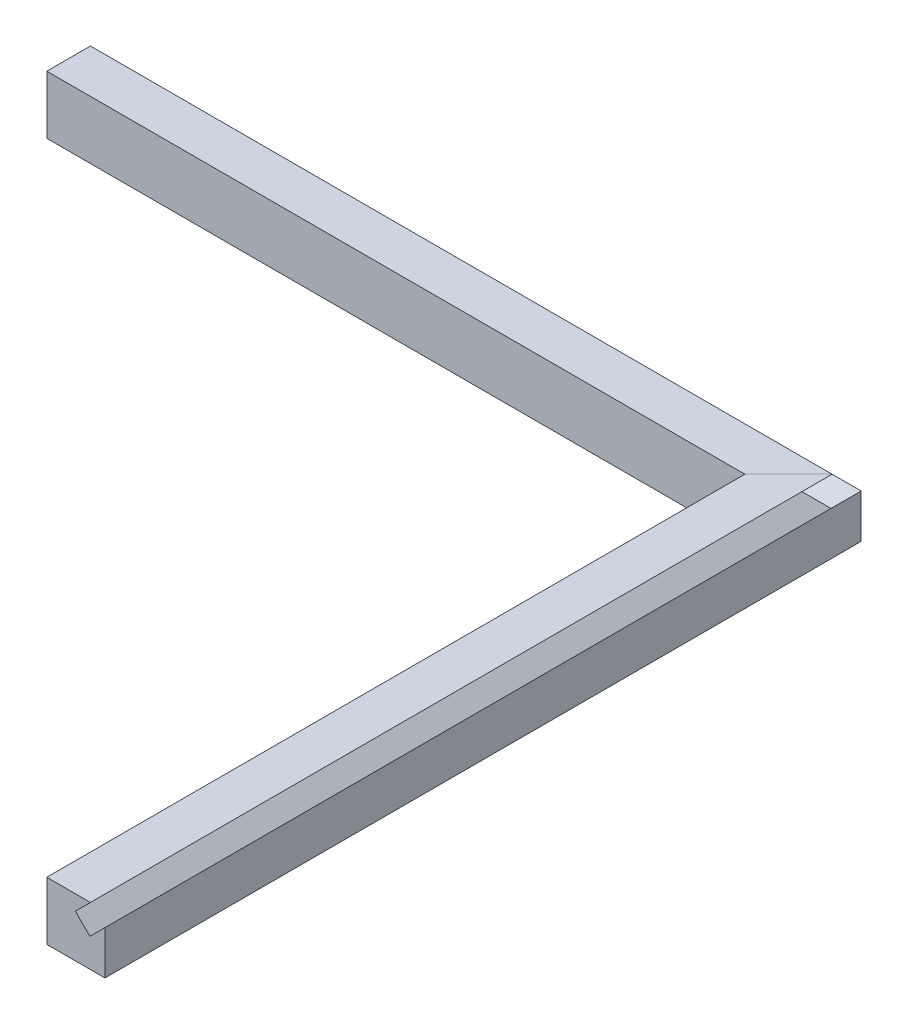
from build123d import *


with BuildPart() as part:
    # Sweep2: sweep along a path in Sketch4
    with BuildLine(Plane(origin=(0, 0, 0), x_dir=(1, 0, 0), z_dir=(0, 1, 0))) as sweep2_path:
        Line((0, 0), (0, 240))
        Line((0, 240), (-240, 240))
    # Sketch3 → Sweep2 (sweep)
    with BuildSketch(Plane.XY):
        Polygon((0, -4.442807786), (0, -24.442807786), (20, -24.442807786), (20, -9.442807786), (14.811670364, -14.631137422), (9.811670364, -9.631137422), (15, -4.442807786), align=None)
    sweep(path=sweep2_path.line, transition=Transition.RIGHT)


solid = part.part
